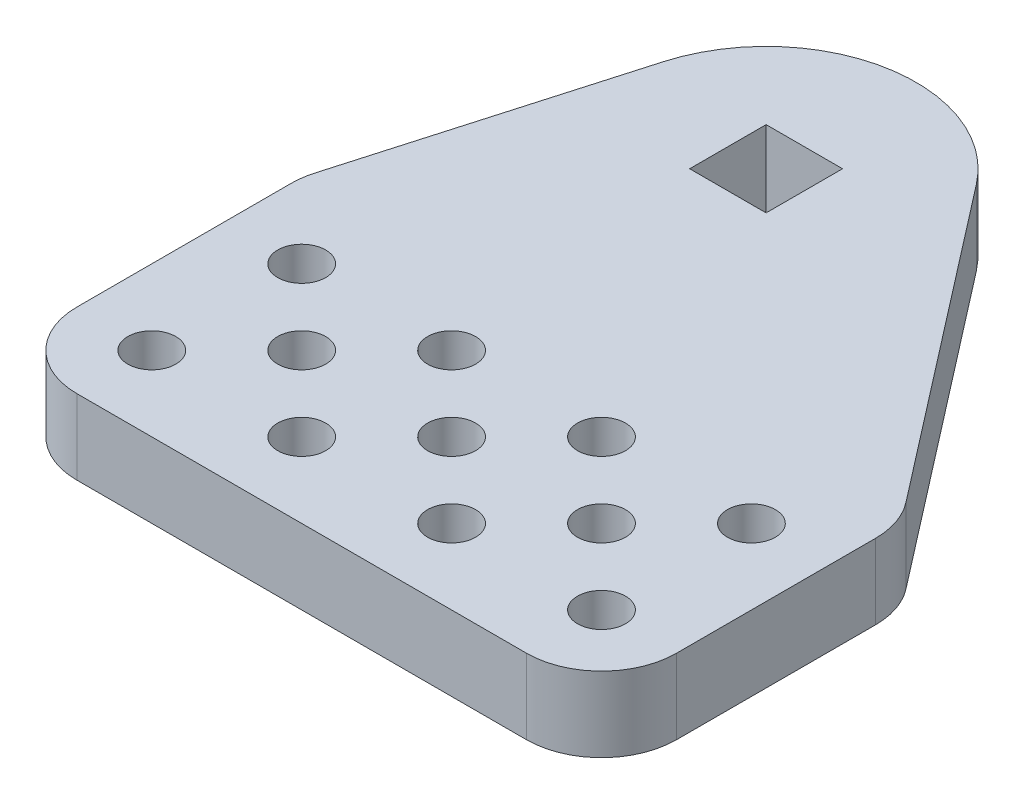
from build123d import *

# Parameters (mm, degrees)
SKETCH1_R           = 2.032
SKETCH1_W           = 6.477
SKETCH1_H           = 6.477
BOSS_EXTRUDE1_DEPTH = 6.35
FILLET1_R           = 6.35


with BuildPart() as part:
    # Sketch1 → Boss-Extrude1 (new body)
    with BuildSketch(Plane(origin=(0, 0, 0), x_dir=(1, 0, 0), z_dir=(0, 1, 0))):
        with BuildLine():
            Line((0, 25.4), (6.844498349, 49.204945244))
            ThreePointArc((6.844498349, 49.204945244), (16.662090732, 58.169055341), (29.096336444, 53.464810065))
            Line((29.096336444, 53.464810065), (50.8, 25.4))
            Line((50.8, 25.4), (50.8, 0))
            Line((50.8, 0), (0, 0))
            Line((0, 0), (0, 25.4))
        make_face()
        with Locations(Location((6.35, 6.35, 0), (0, 0, 270))):
            Circle(SKETCH1_R, mode=Mode.SUBTRACT)
        with Locations(Location((19.05, 6.35, 0), (0, 0, 270))):
            Circle(SKETCH1_R, mode=Mode.SUBTRACT)
        with Locations(Location((31.75, 6.35, 0), (0, 0, 270))):
            Circle(SKETCH1_R, mode=Mode.SUBTRACT)
        with Locations(Location((44.45, 6.35, 0), (0, 0, 270))):
            Circle(SKETCH1_R, mode=Mode.SUBTRACT)
        with Locations(Location((19.05, 19.05, 0), (0, 0, 270))):
            Circle(SKETCH1_R, mode=Mode.SUBTRACT)
        with Locations(Location((31.75, 19.05, 0), (0, 0, 270))):
            Circle(SKETCH1_R, mode=Mode.SUBTRACT)
        with Locations(Location((44.45, 19.05, 0), (0, 0, 270))):
            Circle(SKETCH1_R, mode=Mode.SUBTRACT)
        with Locations(Location((6.35, 19.05, 0), (0, 0, 270))):
            Circle(SKETCH1_R, mode=Mode.SUBTRACT)
        with Locations(Location((12.7, 12.7, 0), (0, 0, 270))):
            Circle(SKETCH1_R, mode=Mode.SUBTRACT)
        with Locations(Location((25.4, 12.7, 0), (0, 0, 270))):
            Circle(SKETCH1_R, mode=Mode.SUBTRACT)
        with Locations(Location((38.1, 12.7, 0), (0, 0, 270))):
            Circle(SKETCH1_R, mode=Mode.SUBTRACT)
        with Locations((19.05, 45.695567884)):
            Rectangle(SKETCH1_W, SKETCH1_H, mode=Mode.SUBTRACT)
    extrude(amount=BOSS_EXTRUDE1_DEPTH)

    # Fillet1
    fillet1_edges = [part.edges().sort_by_distance(p)[0] for p in [
        (0, 3.175, -25.4),
        (50.8, 3.175, -25.4),
        (50.8, 3.175, 0),
        (0, 3.175, 0),
    ]]
    fillet(fillet1_edges, radius=FILLET1_R)


solid = part.part
